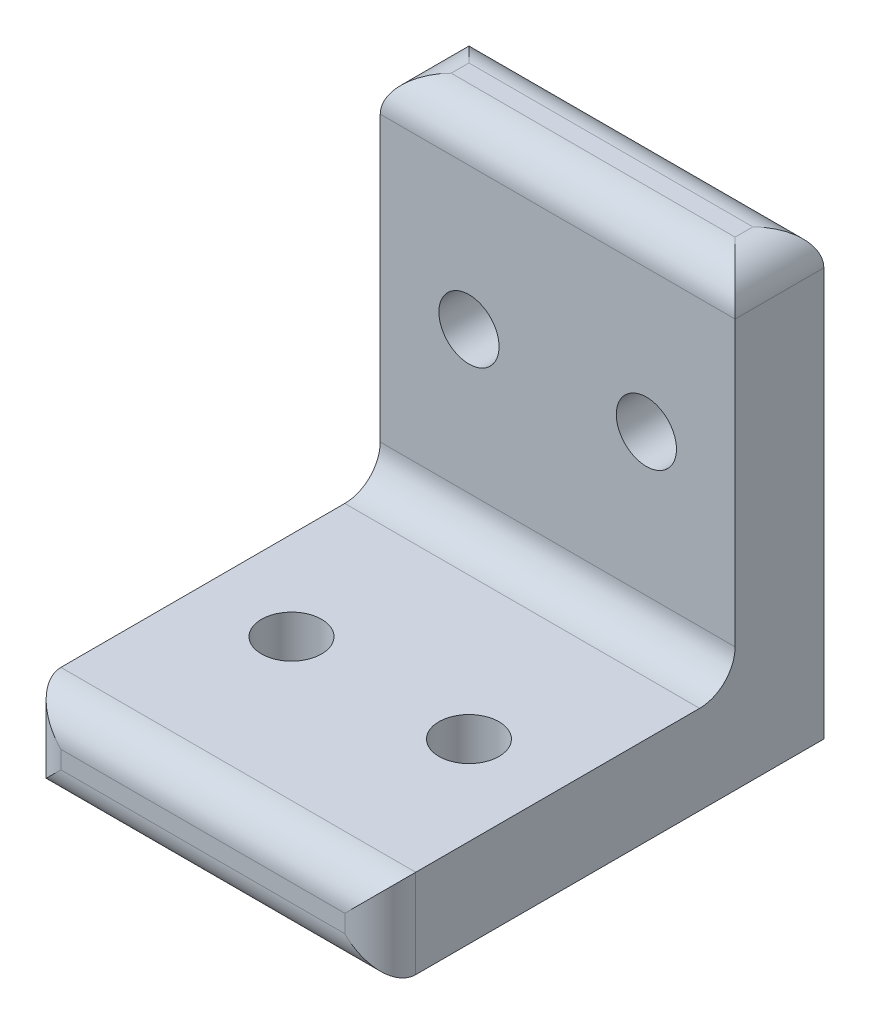
from build123d import *

# Parameters (mm, degrees)
SKETCH1_W             = 25.4
SKETCH1_H             = 25.4
BOSS_EXTRUDE1_DEPTH   = 6.35
SKETCH2_W             = 25.4
SKETCH2_H             = 31.75
BOSS_EXTRUDE2_DEPTH   = 6.35
FILLET1_R             = 2.54
F_8_CLEARANCE_HOLE1_D = 4.3053
F_8_CLEARANCE_HOLE2_D = 4.3053


with BuildPart() as part:
    # Sketch1 → Boss-Extrude1 (new body)
    with BuildSketch(Plane(origin=(0, 0, 0), x_dir=(1, 0, 0), z_dir=(0, 1, 0))):
        Rectangle(SKETCH1_W, SKETCH1_H)
    extrude(amount=BOSS_EXTRUDE1_DEPTH)

    # Sketch2 → Boss-Extrude2 (add)
    with BuildSketch(Plane(origin=(0, 0, -12.7), x_dir=(-1, 0, 0), z_dir=(0, 0, -1))):
        with Locations((0, 15.875)):
            Rectangle(SKETCH2_W, SKETCH2_H)
    extrude(amount=BOSS_EXTRUDE2_DEPTH)

    # Fillet1
    fillet1_edges = [part.edges().sort_by_distance(p)[0] for p in [
        (0, 31.75, -12.7),
        (-12.7, 31.75, -15.875),
        (12.7, 31.75, -15.875),
        (0, 6.35, 12.7),
        (0, 31.75, -19.05),
        (0, 0, 12.7),
        (12.7, 3.175, 12.7),
        (-12.7, 3.175, 12.7),
        (0, 6.35, -12.7),
    ]]
    fillet(fillet1_edges, radius=FILLET1_R)

    # #8 Clearance Hole1 (through all)
    with Locations(Plane(origin=(0, 6.35, 0), x_dir=(1, 0, 0), z_dir=(0, 1, 0))):
        with Locations((-6.35, 0), (6.35, 0)):
            Hole(F_8_CLEARANCE_HOLE1_D / 2)

    # #8 Clearance Hole2 (through all)
    with Locations(Plane.XY.offset(-12.7)):
        with Locations((6.35, 19.05), (-6.35, 19.05)):
            Hole(F_8_CLEARANCE_HOLE2_D / 2)


solid = part.part
